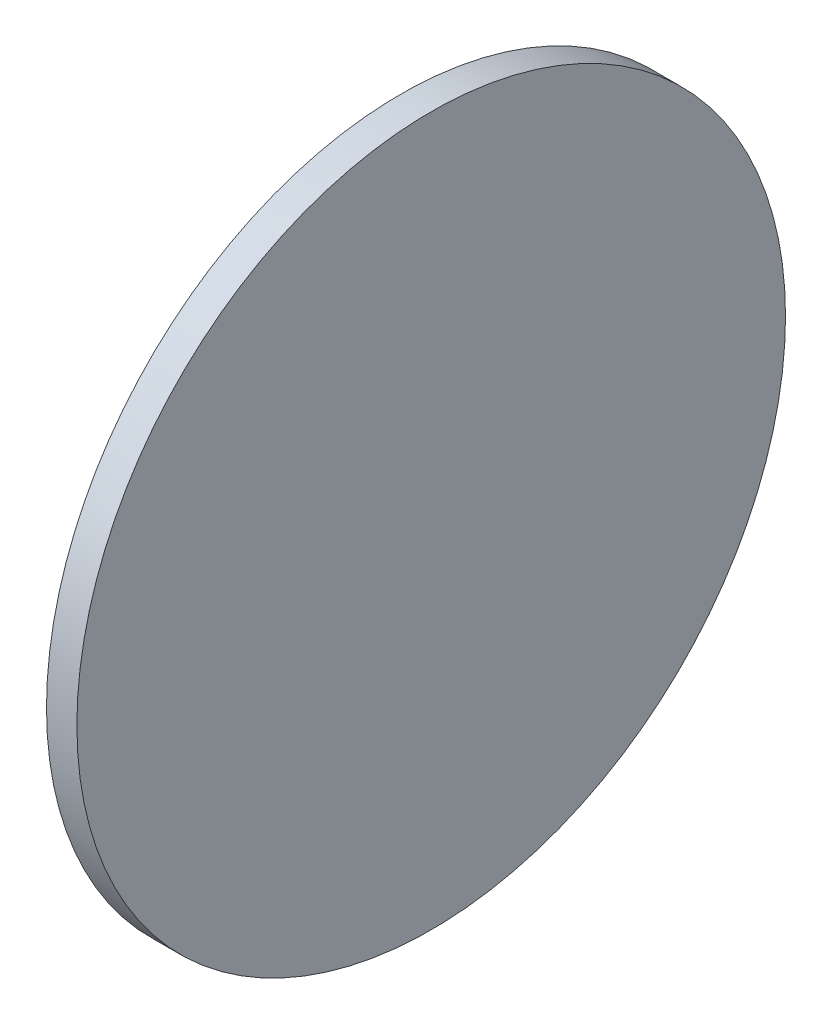
from build123d import *

# Parameters (mm, degrees)
SKETCH1_R           = 74.041
BOSS_EXTRUDE1_DEPTH = 6.35


with BuildPart() as part:
    # Sketch1 → Boss-Extrude1 (new body)
    with BuildSketch(Plane(origin=(0, 0, 0), x_dir=(0, 0, -1), z_dir=(1, 0, 0))):
        Circle(SKETCH1_R)
    extrude(amount=BOSS_EXTRUDE1_DEPTH)


solid = part.part
